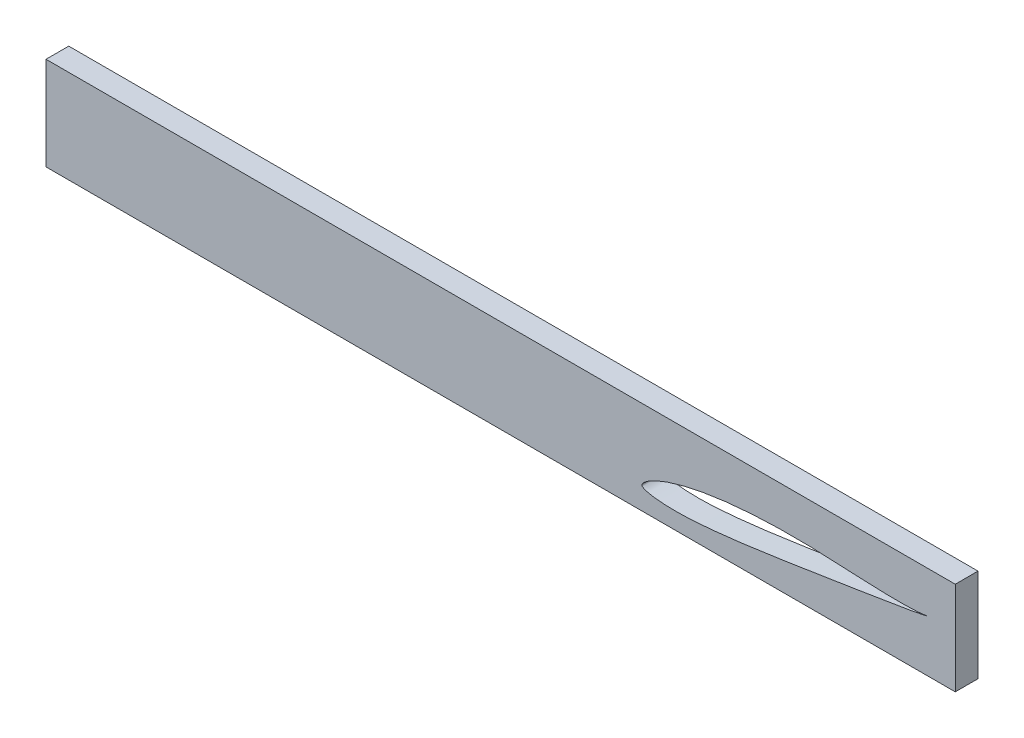
from build123d import *

# Parameters (mm, degrees)
SKETCH1_W           = 159.938164059
SKETCH1_H           = 16.400794502
BOSS_EXTRUDE1_DEPTH = 4


with BuildPart() as part:
    # Sketch1 → Boss-Extrude1 (new body)
    with BuildSketch(Plane.XY.offset(200)):
        with Locations((64.513292045, 2.491072035)):
            Rectangle(SKETCH1_W, SKETCH1_H)
        with BuildLine():
            add(Edge.make_bspline(
                [(139.809734905, 3.400795127), (139.810943815, 3.40314409), (139.441782818, 3.335005524), (139.06380858, 3.292213836), (138.130683453, 3.197141627), (136.98739502, 3.138409801), (135.504679124, 3.092951416), (133.777860637, 3.088995278), (131.822109379, 3.1261572), (129.684950059, 3.201062007), (127.403419568, 3.304692748), (125.016292167, 3.425386346), (122.557825495, 3.546730628), (120.055804124, 3.6441916), (117.532550439, 3.701675459), (115.007270018, 3.711213927), (112.499304119, 3.666825398), (110.028597342, 3.567711715), (107.615879134, 3.41372961), (105.282428412, 3.206695473), (103.049074108, 2.9485684), (100.93556222, 2.640137899), (98.959320455, 2.284667661), (97.135508601, 1.885807525), (95.477665588, 1.450546924), (93.997754673, 0.990975598), (92.707747329, 0.517588035), (91.618667084, 0.040437929), (90.738135076, -0.429113327), (90.072400603, -0.877724237), (89.662169183, -1.249392728), (89.470912837, -1.508644272), (89.401965037, -1.643479263), (89.373551029, -1.728206649), (89.363549991, -1.79444568), (89.368163063, -1.846124222), (89.394994591, -1.891793558), (89.444086972, -1.943554048), (89.521782154, -2.003099508), (89.658392216, -2.084072066), (89.977941224, -2.2325301), (90.571373665, -2.401882295), (91.469854082, -2.566159204), (92.599842314, -2.690587435), (93.948420503, -2.765799107), (95.504688176, -2.783698796), (97.256284137, -2.739233817), (99.190014332, -2.632520866), (101.290357231, -2.463806272), (103.539956343, -2.237308622), (105.918937852, -1.957906262), (108.405214045, -1.634642289), (110.973573795, -1.275526235), (113.596514172, -0.891728672), (116.244007142, -0.491565883), (118.88487813, -0.084530083), (121.487199749, 0.322615351), (124.019437245, 0.722410591), (126.450662864, 1.109798554), (128.751400994, 1.478831733), (130.893680928, 1.825595396), (132.850714192, 2.144180826), (134.599905492, 2.432575528), (136.113188934, 2.685607978), (137.389560805, 2.906713731), (138.364542003, 3.081763584), (139.153518852, 3.241819058), (139.484475018, 3.323643414), (139.808590284, 3.398571082), (139.809734905, 3.400795127)],
                knots=[0, 0, 0, 0, 0.001668894, 0.006746843, 0.015187213, 0.026742062, 0.041154724, 0.058128737, 0.077283286, 0.098227061, 0.120580114, 0.143965619, 0.16801843, 0.19245115, 0.217074812, 0.241709605, 0.266181697, 0.290309902, 0.31390292, 0.336766571, 0.358704118, 0.379539615, 0.399121986, 0.417322023, 0.43403706, 0.449154223, 0.462553001, 0.474138704, 0.48384782, 0.491647296, 0.497539458, 0.499898001, 0.501005481, 0.501950634, 0.502491569, 0.502956186, 0.503431278, 0.504003664, 0.505035339, 0.506275727, 0.508636079, 0.515300989, 0.52421272, 0.535295543, 0.548466715, 0.563638126, 0.580726427, 0.599618642, 0.62017962, 0.642246244, 0.665632648, 0.690118018, 0.71545213, 0.741354376, 0.767519886, 0.79363357, 0.819375078, 0.844428818, 0.868487752, 0.891259121, 0.912467268, 0.931850462, 0.949165438, 0.964196021, 0.976755394, 0.98668803, 0.993909501, 0.998419858, 1, 1, 1, 1], degree=3))
        make_face(mode=Mode.SUBTRACT)
    extrude(amount=BOSS_EXTRUDE1_DEPTH)


solid = part.part
